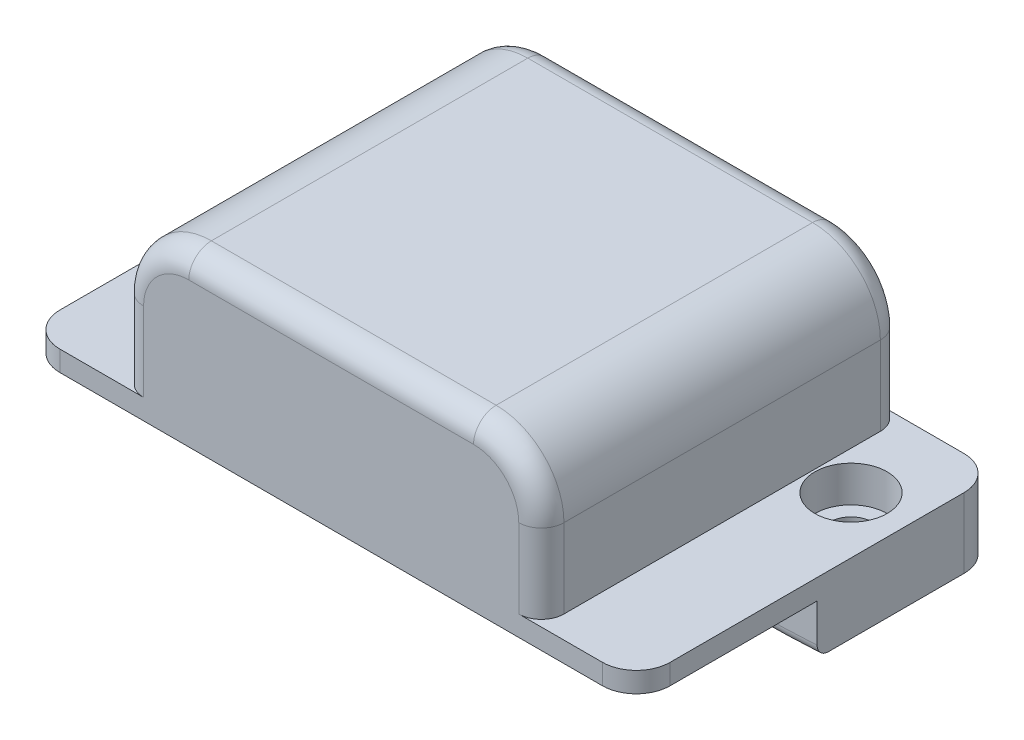
from build123d import *

# Parameters (mm, degrees)
EXTRUDE_1_DEPTH     = 4
CUT_EXTRUDE_1_REACH = 19.27
SKETCH_2_R          = 0.95
SKETCH_5_W          = 15.6
SKETCH_5_H          = 6
CUT_EXTRUDE_2_DEPTH = 8.5
CUT_EXTRUDE_4_DEPTH = 19.607794066
EXTRUDE_2_DEPTH     = 8
SKETCH_12_W         = 15.6
SKETCH_12_H         = 3
EXTRUDE_3_DEPTH     = 5.9
SKETCH_13_R         = 1.6
CUT_EXTRUDE_5_DEPTH = 1.6
FILLET_1_R          = 3
FILLET_2_R          = 1
FILLET_3_R          = 1.5
FILLET_4_R          = 1
FILLET_5_R          = 0.5
FILLET_6_R          = 0.5


with BuildPart() as part:
    # 草图1 → 凸台-拉伸1 (new, symmetric)
    with BuildSketch(Plane.XY):
        Polygon((-13.5, 0), (-13.5, 3.5), (-9.3, 3.5), (-9.3, 10), (9.3, 10), (9.3, 3.5), (13.5, 3.5), (13.5, 0), align=None)
    extrude(amount=EXTRUDE_1_DEPTH, both=True)

    # 草图2 → 切除-拉伸1 (cut, up to next)
    with BuildSketch(Plane.XZ, mode=Mode.PRIVATE) as cut_extrude_1_sk1:
        with Locations((-11, 0)):
            Circle(SKETCH_2_R)
    cut_extrude_1_tool1 = extrude(cut_extrude_1_sk1.sketch, amount=-CUT_EXTRUDE_1_REACH, mode=Mode.PRIVATE) & part.part
    # 草图2 → 切除-拉伸1 (cut, up to next)
    with BuildSketch(Plane.XZ, mode=Mode.PRIVATE) as cut_extrude_1_sk2:
        with Locations((11, 0)):
            Circle(SKETCH_2_R)
    cut_extrude_1_tool2 = extrude(cut_extrude_1_sk2.sketch, amount=-CUT_EXTRUDE_1_REACH, mode=Mode.PRIVATE) & part.part
    add(cut_extrude_1_tool1.solids().sort_by_distance((-11, 0, 0))[0], mode=Mode.SUBTRACT)
    add(cut_extrude_1_tool2.solids().sort_by_distance((11, 0, 0))[0], mode=Mode.SUBTRACT)

    # 草图5 → 切除-拉伸2 (cut)
    with BuildSketch(Plane(origin=(0, 0, 0), x_dir=(-1, 0, 0), z_dir=(0, -1, 0))):
        with Locations((0, -1)):
            Rectangle(SKETCH_5_W, SKETCH_5_H)
    extrude(amount=-CUT_EXTRUDE_2_DEPTH, mode=Mode.SUBTRACT)

    # 草图8 → 切除-拉伸4 (cut, through all)
    with BuildSketch(Plane(origin=(0, 0, -4), x_dir=(-1, 0, 0), z_dir=(0, 0, -1))):
        with BuildLine():
            Line((-18.493720414, 0.960055854), (-18.493720414, -4.039944146))
            Line((-18.493720414, -4.039944146), (18.493720414, -4.039944146))
            Line((18.493720414, -4.039944146), (18.493720414, 0.960055854))
            ThreePointArc((18.493720414, 0.960055854), (11.217877694, 0.317576425), (3.926064508, 0.741990812))
            ThreePointArc((3.926064508, 0.741990812), (0, 1), (-3.926064508, 0.741990812))
            ThreePointArc((-3.926064508, 0.741990812), (-11.217877694, 0.317576425), (-18.493720414, 0.960055854))
        make_face()
    extrude(amount=-CUT_EXTRUDE_4_DEPTH, mode=Mode.SUBTRACT)

    # 草图11 → 凸台-拉伸2 (add)
    with BuildSketch(Plane.XY.offset(4)):
        Polygon((13.5, 2.6), (7.8, 2.6), (7.8, 8.5), (-7.8, 8.5), (-7.8, 2.6), (-13.5, 2.6), (-13.5, 3.5), (-9.3, 3.5), (-9.3, 10), (9.3, 10), (9.3, 3.5), (13.5, 3.5), align=None)
    extrude(amount=EXTRUDE_2_DEPTH)

    # 草图12 → 凸台-拉伸3 (add)
    with BuildSketch(Plane.XZ.offset(-8.5)):
        with Locations((0, 10.5)):
            Rectangle(SKETCH_12_W, SKETCH_12_H)
    extrude(amount=EXTRUDE_3_DEPTH)

    # 草图13 → 切除-拉伸5 (cut)
    with BuildSketch(Plane(origin=(0, 3.5, 0), x_dir=(1, 0, 0), z_dir=(0, 1, 0))):
        with Locations(Location((-11, 0, 0), (0, 0, 270))):
            Circle(SKETCH_13_R)
        with Locations(Location((11, 0, 0), (0, 0, 270))):
            Circle(SKETCH_13_R)
    extrude(amount=-CUT_EXTRUDE_5_DEPTH, mode=Mode.SUBTRACT)

    # 圆角1
    fillet_1_edges = [part.edges().sort_by_distance(p)[0] for p in [
        (-9.3, 10, 4),
        (9.3, 10, 4),
    ]]
    fillet(fillet_1_edges, radius=FILLET_1_R)

    # 圆角2
    fillet_2_edges = [part.edges().sort_by_distance(p)[0] for p in [
        (7.8, 8.5, 3.5),
        (-7.8, 8.5, 3.5),
    ]]
    fillet(fillet_2_edges, radius=FILLET_2_R)

    # 圆角3
    fillet_3_edges = [part.edges().sort_by_distance(p)[0] for p in [
        (13.5, 3.05, 12),
        (-13.5, 3.05, 12),
        (13.5, 1.951949488, -4),
        (-13.5, 1.951949488, -4),
    ]]
    fillet(fillet_3_edges, radius=FILLET_3_R)

    # 圆角4
    fillet_4_edges = [part.edges().sort_by_distance(p)[0] for p in [
        (9.3, 5.25, -4),
        (9.3, 5.25, 12),
        (0, 10, -4),
        (0, 10, 12),
        (-9.3, 5.25, -4),
        (-8.421320344, 9.121320344, -4),
        (8.421320344, 9.121320344, -4),
        (-9.3, 5.25, 12),
        (-8.421320344, 9.121320344, 12),
        (8.421320344, 9.121320344, 12),
    ]]
    fillet(fillet_4_edges, radius=FILLET_4_R)

    # 圆角5
    fillet_5_edges = [part.edges().sort_by_distance(p)[0] for p in [
        (10.650293934, 0.312302345, 4),
        (-10.650293934, 0.312302345, 4),
    ]]
    fillet(fillet_5_edges, radius=FILLET_5_R)

    # 圆角6
    fillet_6_edges = [part.edges().sort_by_distance(p)[0] for p in [
        (7.8, 5.05, 9),
        (-7.8, 5.05, 9),
        (-7.8, 3.941644472, -2),
        (0, 8.5, 9),
        (7.507106781, 8.207106781, 9),
        (-7.507106781, 8.207106781, 9),
        (0, 8.5, -2),
        (7.8, 3.941644472, -2),
        (7.507106781, 8.207106781, -2),
        (-7.507106781, 8.207106781, -2),
    ]]
    fillet(fillet_6_edges, radius=FILLET_6_R)


solid = part.part
